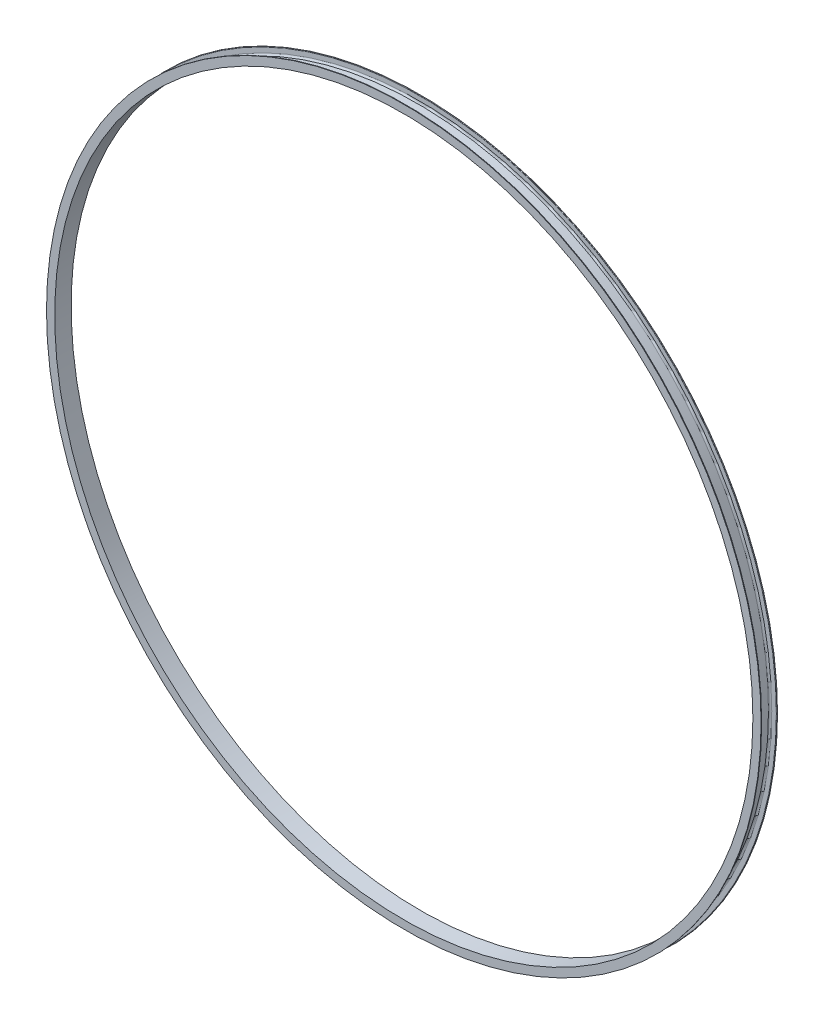
from build123d import *


with BuildPart() as part:
    # Sketch1 → Revolve1 (revolve)
    with BuildSketch(Plane(origin=(0, 0, 0), x_dir=(1, 0, 0), z_dir=(0, 1, 0))):
        with BuildLine():
            Line((850, 0), (850, 20))
            Line((850, 20), (870, 20))
            Line((870, 20), (870, 19))
            ThreePointArc((870, 19), (869.707106781, 18.292893219), (869, 18))
            Line((869, 18), (858, 18))
            ThreePointArc((858, 18), (855.171572875, 16.828427125), (854, 14))
            Line((854, 14), (854, -14))
            ThreePointArc((854, -14), (855.171572875, -16.828427125), (858, -18))
            Line((858, -18), (869, -18))
            ThreePointArc((869, -18), (869.707106781, -18.292893219), (870, -19))
            Line((870, -19), (870, -20))
            Line((870, -20), (850, -20))
            Line((850, -20), (850, 0))
        make_face()
    revolve(axis=Axis((0, 0, 0), (0, 0, -1)))


solid = part.part
